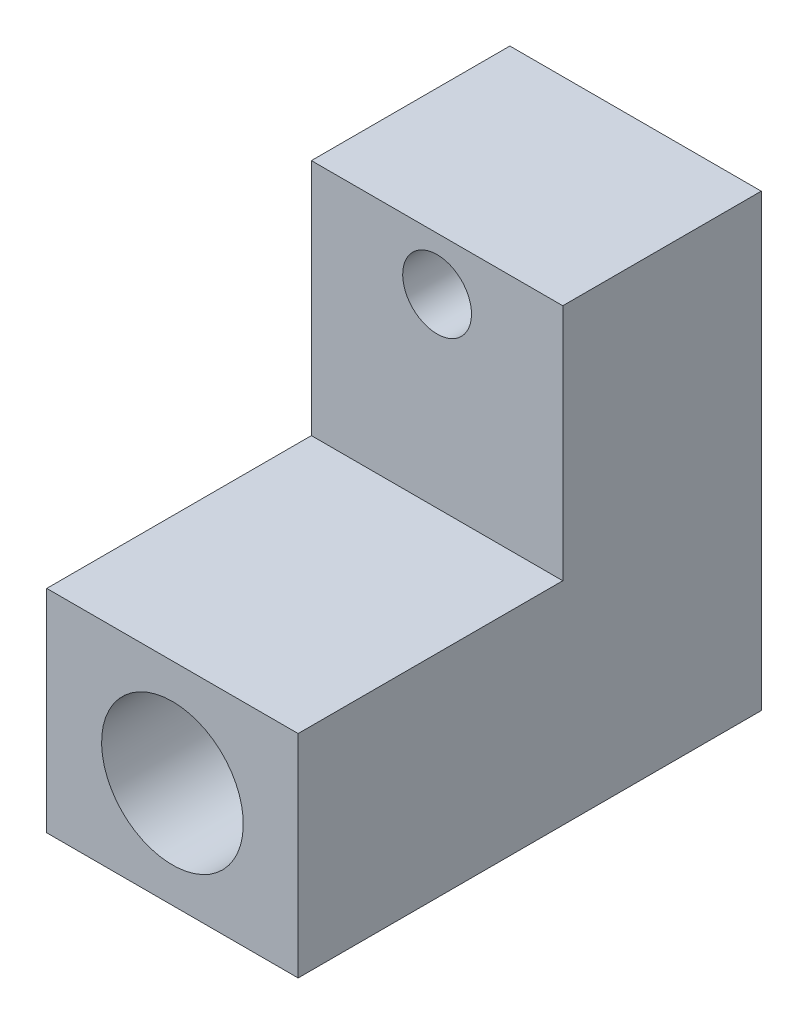
from build123d import *

# Parameters (mm, degrees)
BOSS_EXTRUDE1_DEPTH          = 12.065
TAP_DRILL_FOR_M8X1_25_TAP1_D = 6.8
SKETCH6_R                    = 1.651
CUT_EXTRUDE2_DEPTH           = 34.251209752


with BuildPart() as part:
    # Sketch1 → Boss-Extrude1 (new body)
    with BuildSketch(Plane(origin=(0, 0, 0), x_dir=(0, 0, -1), z_dir=(1, 0, 0))):
        Polygon((0, 0), (0, 10.16), (12.7, 10.16), (12.7, 21.59), (22.225, 21.59), (22.225, 0), align=None)
    extrude(amount=-BOSS_EXTRUDE1_DEPTH)

    # Tap Drill for M8x1.25 Tap1 (through all)
    with Locations(Plane(origin=(-0.703177612, 1.547352974, -22.225), x_dir=(1, 0, 0), z_dir=(0, 0, -1))):
        with Locations((-5.329322388, -3.532647026)):
            Hole(TAP_DRILL_FOR_M8X1_25_TAP1_D / 2)

    # Sketch6 → Cut-Extrude2 (cut, through all)
    with BuildSketch(Plane(origin=(0, 0, -22.225), x_dir=(-1, 0, 0), z_dir=(0, 0, -1))):
        with Locations(Location((6.0325, 19.05, 0), (0, 0, 90))):
            Circle(SKETCH6_R)
    extrude(amount=-CUT_EXTRUDE2_DEPTH, mode=Mode.SUBTRACT)


solid = part.part
